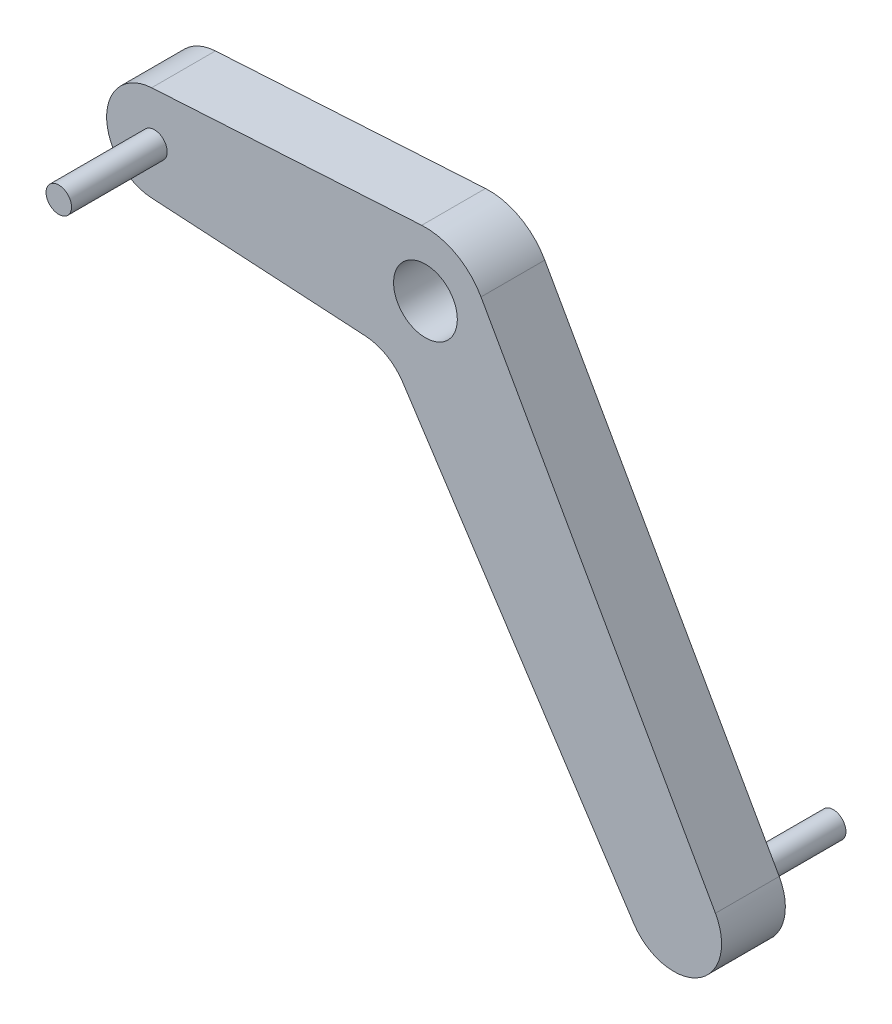
from build123d import *

# Parameters (mm, degrees)
EXTRUDE_1_DEPTH     = 20
SKETCH_2_R          = 10
CUT_EXTRUDE_1_DEPTH = 20
SKETCH_6_R          = 4
EXTRUDE_3_DEPTH     = 30
SKETCH_7_R          = 4
EXTRUDE_4_DEPTH     = 30


with BuildPart() as part:
    # 草图1 → 凸台-拉伸1 (new body)
    with BuildSketch(Plane.XY):
        with BuildLine():
            Line((-1.176470588, 19.965367939), (-85.882352941, 14.974025955))
            ThreePointArc((-85.882352941, 14.974025955), (-100, 0), (-85.882352941, -14.974025955))
            Line((-85.882352941, -14.974025955), (-18.763483586, -18.92904326))
            ThreePointArc((-18.763483586, -18.92904326), (-12.125205702, -20.924621234), (-7.09296905, -25.691764928))
            Line((-7.09296905, -25.691764928), (65.330255198, -136.407322955))
            ThreePointArc((65.330255198, -136.407322955), (85.671434943, -141.015620535), (90.955210971, -120.839354505))
            Line((90.955210971, -120.839354505), (17.42945106, 9.80888555))
            ThreePointArc((17.42945106, 9.80888555), (9.582712413, 17.554817653), (-1.176470588, 19.965367939))
        make_face()
    extrude(amount=EXTRUDE_1_DEPTH)

    # 草图2 → 切除-拉伸1 (cut)
    with BuildSketch(Plane.XY):
        Circle(SKETCH_2_R)
    extrude(amount=CUT_EXTRUDE_1_DEPTH, mode=Mode.SUBTRACT)

    # 草图6 → 凸台-拉伸3 (add)
    with BuildSketch(Plane.XY.offset(20)):
        with Locations((-85, 0)):
            Circle(SKETCH_6_R)
    extrude(amount=EXTRUDE_3_DEPTH)

    # 草图7 → 凸台-拉伸4 (add)
    with BuildSketch(Plane(origin=(0, 0, 0), x_dir=(-1, 0, 0), z_dir=(0, 0, -1))):
        with Locations(Location((-77.883122675, -128.196018668, 0), (0, 0, 180))):
            Circle(SKETCH_7_R)
    extrude(amount=EXTRUDE_4_DEPTH)


solid = part.part
